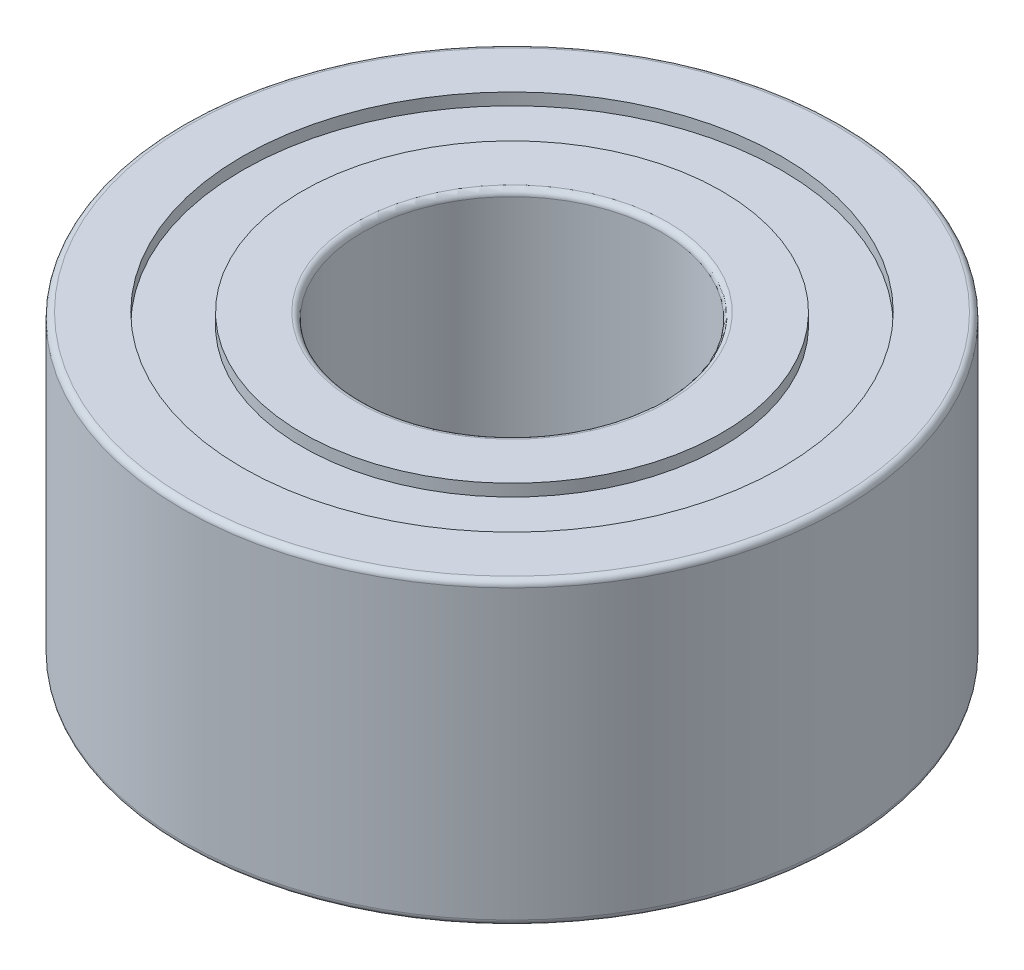
from build123d import *


with BuildPart() as part:
    # Croquis1 → Revolución1 (revolve)
    with BuildSketch(Plane(origin=(0, 0, 0), x_dir=(0, 0, -1), z_dir=(1, 0, 0))):
        with BuildLine():
            Line((2.5, -2.4), (2.5, 2.4))
            ThreePointArc((2.5, 2.4), (2.529289322, 2.470710678), (2.6, 2.5))
            Line((2.6, 2.5), (3.5, 2.5))
            Line((3.5, 2.5), (3.5, 2.3))
            Line((3.5, 2.3), (4.5, 2.3))
            Line((4.5, 2.3), (4.5, 2.5))
            Line((4.5, 2.5), (5.4, 2.5))
            ThreePointArc((5.4, 2.5), (5.470710678, 2.470710678), (5.5, 2.4))
            Line((5.5, 2.4), (5.5, -2.4))
            ThreePointArc((5.5, -2.4), (5.470710678, -2.470710678), (5.4, -2.5))
            Line((5.4, -2.5), (4.779574592, -2.5))
            Line((4.779574592, -2.5), (4.779574592, -2.3))
            Line((4.779574592, -2.3), (3.220425408, -2.3))
            Line((3.220425408, -2.3), (3.220425408, -2.5))
            Line((3.220425408, -2.5), (2.6, -2.5))
            ThreePointArc((2.6, -2.5), (2.529289322, -2.470710678), (2.5, -2.4))
        make_face()
    revolve(axis=Axis((0, -2.255244755, 0), (0, 1, 0)))


solid = part.part
